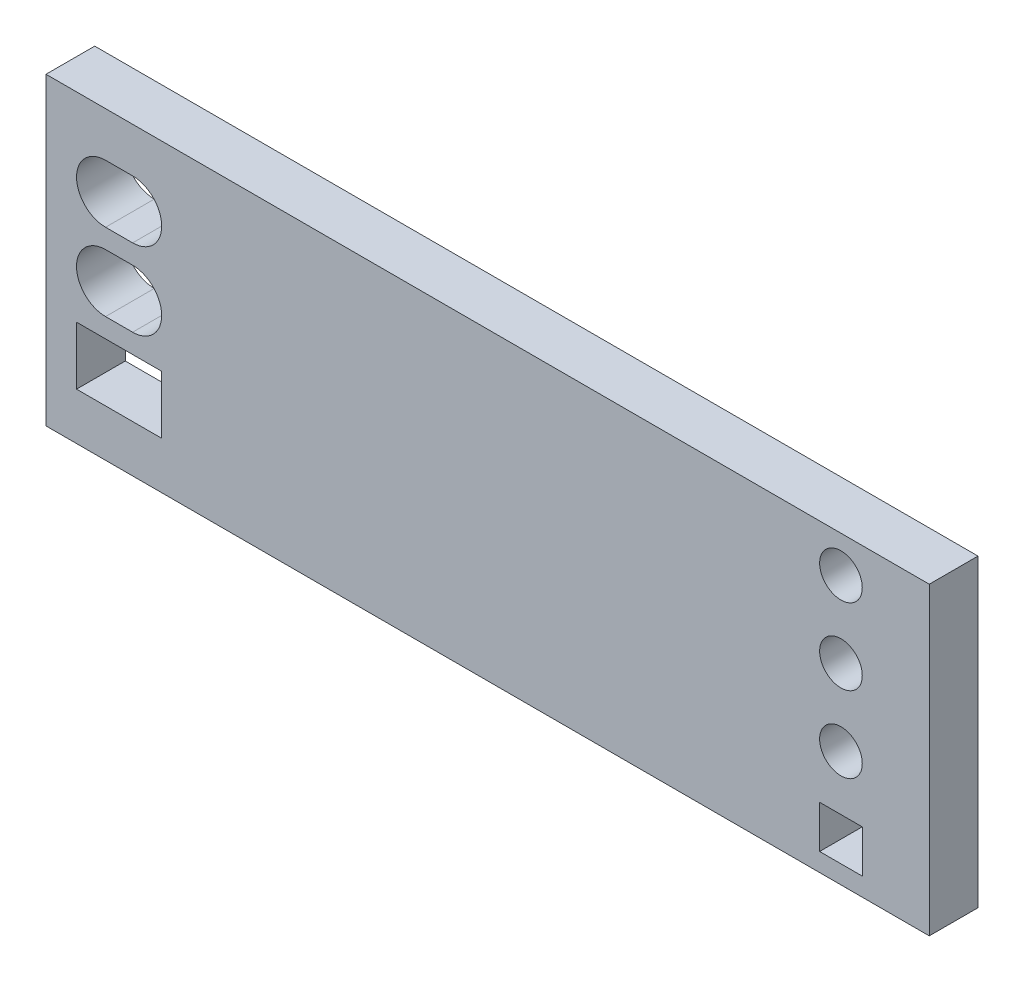
from build123d import *

# Parameters (mm, degrees)
MODEL_W            = 29
MODEL_H            = 10
MODEL_R            = 0.7
MODEL_W_2          = 2.794
MODEL_H_2          = 1.905
MODEL_W_3          = 1.4
MODEL_H_3          = 1.4
BOSS_EXTRU_1_DEPTH = 1.6


with BuildPart() as part:
    # Model → Boss.-Extru.1 (new body)
    with BuildSketch(Plane.XY):
        with Locations((14.5, 5)):
            Rectangle(MODEL_W, MODEL_H)
        with Locations((26.1, 3.8)):
            Circle(MODEL_R, mode=Mode.SUBTRACT)
        with Locations((26.1, 6.3)):
            Circle(MODEL_R, mode=Mode.SUBTRACT)
        with Locations((26.1, 8.8)):
            Circle(MODEL_R, mode=Mode.SUBTRACT)
        with Locations((2.4, 2.5)):
            Rectangle(MODEL_W_2, MODEL_H_2, mode=Mode.SUBTRACT)
        with BuildLine():
            Line((1.9555, 5.9925), (2.8445, 5.9925))
            ThreePointArc((2.8445, 5.9925), (3.797, 5.04), (2.8445, 4.0875))
            Line((2.8445, 4.0875), (1.9555, 4.0875))
            ThreePointArc((1.9555, 4.0875), (1.003, 5.04), (1.9555, 5.9925))
        make_face(mode=Mode.SUBTRACT)
        with BuildLine():
            Line((1.9555, 8.5325), (2.8445, 8.5325))
            ThreePointArc((2.8445, 8.5325), (3.797, 7.58), (2.8445, 6.6275))
            Line((2.8445, 6.6275), (1.9555, 6.6275))
            ThreePointArc((1.9555, 6.6275), (1.003, 7.58), (1.9555, 8.5325))
        make_face(mode=Mode.SUBTRACT)
        with Locations((26.1, 1.3)):
            Rectangle(MODEL_W_3, MODEL_H_3, mode=Mode.SUBTRACT)
    extrude(amount=BOSS_EXTRU_1_DEPTH)


solid = part.part
